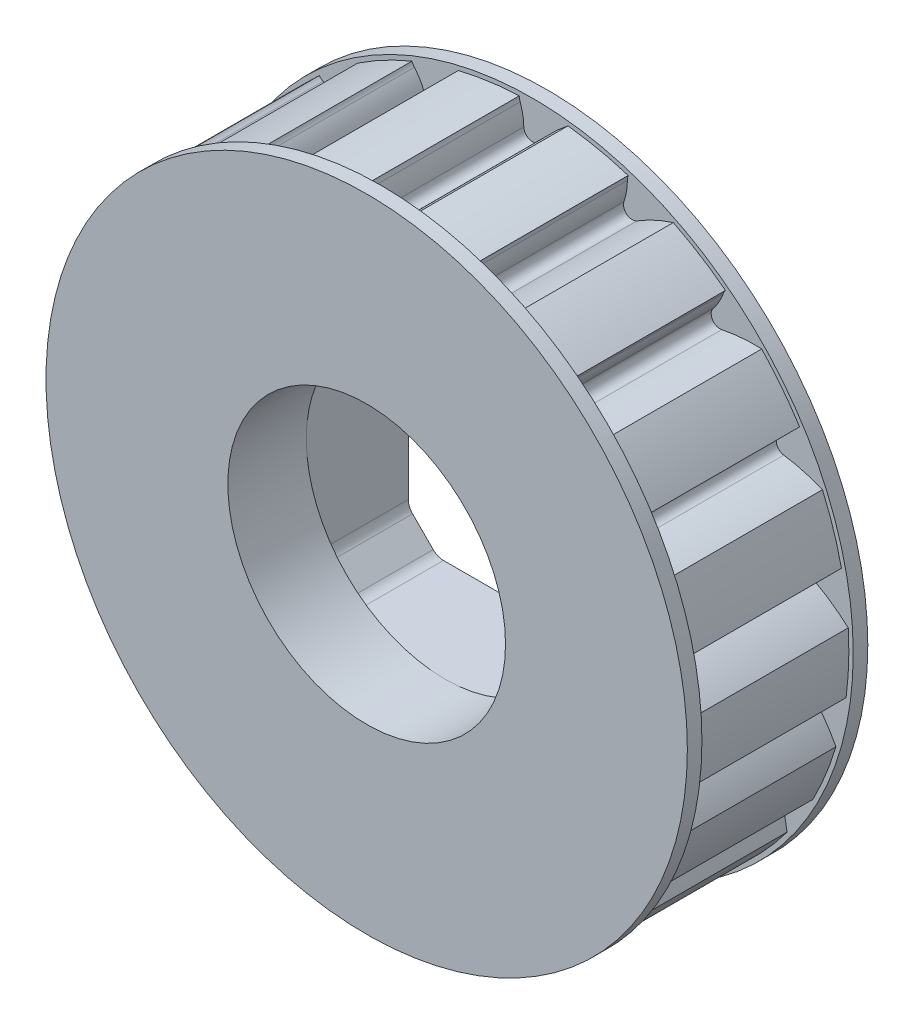
from build123d import *

# Parameters (mm, degrees)
SKETCH1_R             = 25
BOSS_EXTRUDE1_DEPTH   = 12.38
BOSS_EXTRUDE4_START   = -5.38
SKETCH9_R             = 25
SKETCH9_R_2           = 9.525
BOSS_EXTRUDE4_DEPTH   = 5.38
SKETCH4_OUTSIDE_W     = 66.358
SKETCH4_OUTSIDE_H     = 66.358
SKETCH4_OUTSIDE_R     = 22
TREAD_CLEARANCE_DEPTH = 38.460170849
CUT_EXTRUDE2_START    = 1
SKETCH5_OUTSIDE_W     = 58.688
SKETCH5_OUTSIDE_H     = 58.688
SKETCH5_OUTSIDE_R     = 21.7
CUT_EXTRUDE2_DEPTH    = 10.38
CUT_EXTRUDE3_DEPTH    = 10.38
CIRPATTERN4_COUNT     = 18


with BuildPart() as part:
    # Sketch1 → Boss-Extrude1 (new body)
    with BuildSketch(Plane.XY):
        with Locations(Location((0, 0, 0), (0, 0, 90))):
            Circle(SKETCH1_R)
        with BuildLine():
            Line((9.525, -7.110786438), (9.525, 7.110786438))
            ThreePointArc((9.525, 7.110786438), (9.448879533, 7.49346987), (9.232106781, 7.817893219))
            Line((9.232106781, 7.817893219), (7.817893219, 9.232106781))
            ThreePointArc((7.817893219, 9.232106781), (7.49346987, 9.448879533), (7.110786438, 9.525))
            Line((7.110786438, 9.525), (-7.110786438, 9.525))
            ThreePointArc((-7.110786438, 9.525), (-7.49346987, 9.448879533), (-7.817893219, 9.232106781))
            Line((-7.817893219, 9.232106781), (-9.232106781, 7.817893219))
            ThreePointArc((-9.232106781, 7.817893219), (-9.448879533, 7.49346987), (-9.525, 7.110786438))
            Line((-9.525, 7.110786438), (-9.525, -7.110786438))
            ThreePointArc((-9.525, -7.110786438), (-9.448879533, -7.49346987), (-9.232106781, -7.817893219))
            Line((-9.232106781, -7.817893219), (-7.817893219, -9.232106781))
            ThreePointArc((-7.817893219, -9.232106781), (-7.49346987, -9.448879533), (-7.110786438, -9.525))
            Line((-7.110786438, -9.525), (7.110786438, -9.525))
            ThreePointArc((7.110786438, -9.525), (7.49346987, -9.448879533), (7.817893219, -9.232106781))
            Line((7.817893219, -9.232106781), (9.232106781, -7.817893219))
            ThreePointArc((9.232106781, -7.817893219), (9.448879533, -7.49346987), (9.525, -7.110786438))
        make_face(mode=Mode.SUBTRACT)
    extrude(amount=BOSS_EXTRUDE1_DEPTH)

    # Sketch9 → Boss-Extrude4 (add)
    with BuildSketch(Plane.XY.offset(12.38).offset(BOSS_EXTRUDE4_START)):
        with Locations(Location((0, 0, 0), (0, 0, 90))):
            Circle(SKETCH9_R)
        Circle(SKETCH9_R_2, mode=Mode.SUBTRACT)
    extrude(amount=BOSS_EXTRUDE4_DEPTH)

    # Sketch4 outside → Tread Clearance (cut, through all)
    with BuildSketch(Plane.XY.offset(12.38)):
        Rectangle(SKETCH4_OUTSIDE_W, SKETCH4_OUTSIDE_H)
        Circle(SKETCH4_OUTSIDE_R, mode=Mode.SUBTRACT)
    extrude(amount=-TREAD_CLEARANCE_DEPTH, mode=Mode.SUBTRACT)

    # Sketch5 outside → Cut-Extrude2 (cut)
    with BuildSketch(Plane.XY.offset(CUT_EXTRUDE2_START)):
        Rectangle(SKETCH5_OUTSIDE_W, SKETCH5_OUTSIDE_H)
        with Locations(Location((0, 0, 0), (0, 0, 90))):
            Circle(SKETCH5_OUTSIDE_R, mode=Mode.SUBTRACT)
    extrude(amount=CUT_EXTRUDE2_DEPTH, mode=Mode.SUBTRACT)

    # Sketch6 → Cut-Extrude3 (cut)
    with BuildSketch(Plane.XY.offset(1)):
        with BuildLine():
            ThreePointArc((6.505756366, 20.361958768), (6.446827822, 19.666593295), (6.273572546, 18.99058418))
            ThreePointArc((6.273572546, 18.99058418), (6.465736016, 18.325211027), (7.157089189, 18.284235134))
            ThreePointArc((7.157089189, 18.284235134), (8.371042068, 18.936944495), (9.657089189, 19.432720561))
            ThreePointArc((9.657089189, 19.432720561), (8.132554572, 20.118438213), (6.559758729, 20.684766506))
            ThreePointArc((6.559758729, 20.684766506), (6.519461312, 20.525586959), (6.505756366, 20.361958768))
        make_face()
    cut_extrude3 = extrude(amount=CUT_EXTRUDE3_DEPTH, mode=Mode.SUBTRACT)

    # CirPattern4: Cut-Extrude3 ×18 about axis
    cirpattern4_axis = Axis((0, 0, 0), (0, 0, 1))
    for i in range(1, CIRPATTERN4_COUNT):
        add(cut_extrude3.rotate(cirpattern4_axis, i * 360 / CIRPATTERN4_COUNT), mode=Mode.SUBTRACT)


solid = part.part
